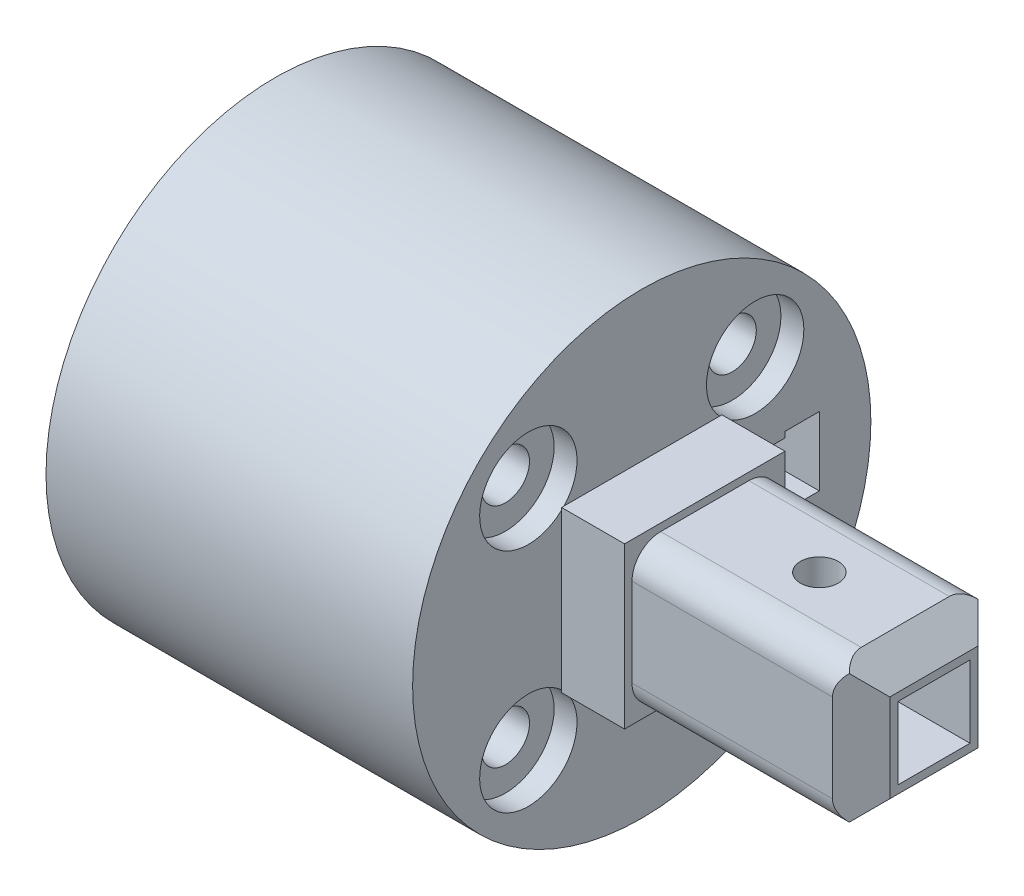
from build123d import *

# Parameters (mm, degrees)
SKETCH_1_R               = 20
EXTRUDE_1_DEPTH          = 5
SKETCH_2_W               = 6.3
SKETCH_2_H               = 6.3
CUT_EXTRUDE_1_DEPTH      = 5
EXTRUDE_START            = 7
SKETCH_4_R               = 20
SKETCH_4_R_2             = 10
EXTRUDE_2_DEPTH          = 7
CUT_EXTRUDE_2_DEPTH      = 20
CUT_EXTRUDE_2_DEPTH_BACK = 20
SKETCH_3_R               = 2.1
SKETCH_5_W               = 3
SKETCH_5_H               = 6
CUT_EXTRUDE_3_DEPTH      = 13
CHAMFER_1_SIZE           = 1
EXTRUDE_START_2          = 20
SKETCH_6_R               = 20
SKETCH_6_R_2             = 18
EXTRUDE_3_DEPTH          = 20
CHAMFER_2_SIZE           = 1
SKETCH_7_R               = 4.25
CUT_EXTRUDE_4_DEPTH      = 2
SKETCH_8_W               = 14
SKETCH_8_H               = 14
EXTRUDE_4_DEPTH          = 5.5
SKETCH_9_W               = 6.3
SKETCH_9_H               = 6.3
CUT_EXTRUDE_5_DEPTH      = 10
CUT_EXTRUDE_6_DEPTH      = 6
CUT_EXTRUDE_6_DEPTH_BACK = 5
SKETCH_10_W              = 3
SKETCH_10_H              = 5
FILLET_1_R               = 4
FILLET_2_R               = 2
SKETCH_11_W              = 12.7
SKETCH_11_H              = 12.7
SKETCH_11_W_2            = 6.3
SKETCH_11_H_2            = 6.3
EXTRUDE_5_DEPTH          = 20
CHAMFER_3_SIZE           = 2.5
SKETCH_12_R              = 1.65
CUT_EXTRUDE_7_DEPTH      = 20
FILLET_3_R               = 2.5


with BuildPart() as part:
    # 草图1 → 凸台-拉伸1 (new body)
    with BuildSketch(Plane(origin=(0, 0, 0), x_dir=(0, 0, -1), z_dir=(1, 0, 0))):
        Circle(SKETCH_1_R)
    extrude(amount=EXTRUDE_1_DEPTH)

    # 草图2 → 切除-拉伸1 (cut)
    with BuildSketch(Plane(origin=(5, 0, 0), x_dir=(0, 0, -1), z_dir=(1, 0, 0))):
        Rectangle(SKETCH_2_W, SKETCH_2_H)
    extrude(amount=-CUT_EXTRUDE_1_DEPTH, mode=Mode.SUBTRACT)

    # 草图4 → 凸台-拉伸2 (add)
    with BuildSketch(Plane.ZY.offset(EXTRUDE_START)):
        Circle(SKETCH_4_R)
        Circle(SKETCH_4_R_2, mode=Mode.SUBTRACT)
    extrude(amount=-EXTRUDE_2_DEPTH)

    # 草图3 → 切除-拉伸2 (cut, two sides: drawn at the far end of the back side and taken through both)
    with BuildSketch(Plane.ZY.offset(-CUT_EXTRUDE_2_DEPTH_BACK)):
        with Locations(Location((9.899494937, -9.899494937, 0), (0, 0, 180))):
            Circle(SKETCH_3_R)
        with Locations(Location((-9.899494937, -9.899494937, 0), (0, 0, 180))):
            Circle(SKETCH_3_R)
        with Locations(Location((-9.899494937, 9.899494937, 0), (0, 0, 180))):
            Circle(SKETCH_3_R)
        with Locations(Location((9.899494937, 9.899494937, 0), (0, 0, 180))):
            Circle(SKETCH_3_R)
    extrude(amount=CUT_EXTRUDE_2_DEPTH + CUT_EXTRUDE_2_DEPTH_BACK, mode=Mode.SUBTRACT)

    # 草图5 → 切除-拉伸3 (cut)
    with BuildSketch(Plane(origin=(5, 0, 0), x_dir=(0, 0, -1), z_dir=(1, 0, 0))):
        with Locations((14, 0)):
            Rectangle(SKETCH_5_W, SKETCH_5_H)
    extrude(amount=-CUT_EXTRUDE_3_DEPTH, mode=Mode.SUBTRACT)

    # 倒角1
    chamfer_1_edges = [part.edges().sort_by_distance(p)[0] for p in [
        (-7, -3, -14),
        (-7, 0, -15.5),
        (-7, 3, -14),
        (-7, 0, -12.5),
    ]]
    chamfer(chamfer_1_edges, length=CHAMFER_1_SIZE)

    # 草图6 → 凸台-拉伸3 (add)
    with BuildSketch(Plane.ZY.offset(7).offset(EXTRUDE_START_2)):
        Circle(SKETCH_6_R)
        Circle(SKETCH_6_R_2, mode=Mode.SUBTRACT)
    extrude(amount=-EXTRUDE_3_DEPTH)

    # 倒角2
    chamfer_2_edges = [part.edges().sort_by_distance(p)[0] for p in [
        (-27, 0, -18),
    ]]
    chamfer(chamfer_2_edges, length=CHAMFER_2_SIZE)

    # 草图7 → 切除-拉伸4 (cut)
    with BuildSketch(Plane(origin=(5, 0, 0), x_dir=(0, 0, -1), z_dir=(1, 0, 0))):
        with Locations((-9.899494937, 9.899494937)):
            Circle(SKETCH_7_R)
        with Locations((9.899494937, 9.899494937)):
            Circle(SKETCH_7_R)
        with Locations((9.899494937, -9.899494937)):
            Circle(SKETCH_7_R)
        with Locations((-9.899494937, -9.899494937)):
            Circle(SKETCH_7_R)
    extrude(amount=-CUT_EXTRUDE_4_DEPTH, mode=Mode.SUBTRACT)

    # 草图8 → 凸台-拉伸4 (add)
    with BuildSketch(Plane(origin=(5, 0, 0), x_dir=(0, 0, -1), z_dir=(1, 0, 0))):
        Rectangle(SKETCH_8_W, SKETCH_8_H)
    extrude(amount=EXTRUDE_4_DEPTH)

    # 草图9 → 切除-拉伸5 (cut)
    with BuildSketch(Plane.ZY.offset(-5)):
        Rectangle(SKETCH_9_W, SKETCH_9_H)
    extrude(amount=-CUT_EXTRUDE_5_DEPTH, mode=Mode.SUBTRACT)

    # 草图10 → 切除-拉伸6 (cut, two sides: drawn at the far end of the back side and taken through both)
    with BuildSketch(Plane(origin=(0, 0, -7), x_dir=(-1, 0, 0), z_dir=(0, 0, -1)).offset(-CUT_EXTRUDE_6_DEPTH_BACK)):
        with Locations((-5, 0)):
            Rectangle(SKETCH_10_W, SKETCH_10_H)
    extrude(amount=CUT_EXTRUDE_6_DEPTH + CUT_EXTRUDE_6_DEPTH_BACK, mode=Mode.SUBTRACT)

    # 圆角1
    fillet_1_edges = [part.edges().sort_by_distance(p)[0] for p in [
        (3.5, 0, -12.5),
    ]]
    fillet(fillet_1_edges, radius=FILLET_1_R)

    # 圆角2
    fillet_2_edges = [part.edges().sort_by_distance(p)[0] for p in [
        (6.5, 0, -3.15),
    ]]
    fillet(fillet_2_edges, radius=FILLET_2_R)

    # 草图11 → 凸台-拉伸5 (add)
    with BuildSketch(Plane(origin=(10.5, 0, 0), x_dir=(0, 0, -1), z_dir=(1, 0, 0))):
        Rectangle(SKETCH_11_W, SKETCH_11_H)
        Rectangle(SKETCH_11_W_2, SKETCH_11_H_2, mode=Mode.SUBTRACT)
    extrude(amount=EXTRUDE_5_DEPTH)

    # 倒角3
    chamfer_3_edges = [part.edges().sort_by_distance(p)[0] for p in [
        (30.5, 0, 6.35),
        (30.5, -6.35, 0),
        (30.5, 0, -6.35),
        (30.5, 6.35, 0),
    ]]
    chamfer(chamfer_3_edges, length=CHAMFER_3_SIZE)

    # 草图12 → 切除-拉伸7 (cut)
    with BuildSketch(Plane.XZ.offset(6.35)):
        with Locations(Location((20.5, 0, 0), (0, 0, 270))):
            Circle(SKETCH_12_R)
    extrude(amount=-CUT_EXTRUDE_7_DEPTH, mode=Mode.SUBTRACT)

    # 圆角3
    fillet_3_edges = [part.edges().sort_by_distance(p)[0] for p in [
        (19.25, 6.35, 6.35),
        (19.25, 6.35, -6.35),
        (19.25, -6.35, -6.35),
        (19.25, -6.35, 6.35),
    ]]
    fillet(fillet_3_edges, radius=FILLET_3_R)


solid = part.part
